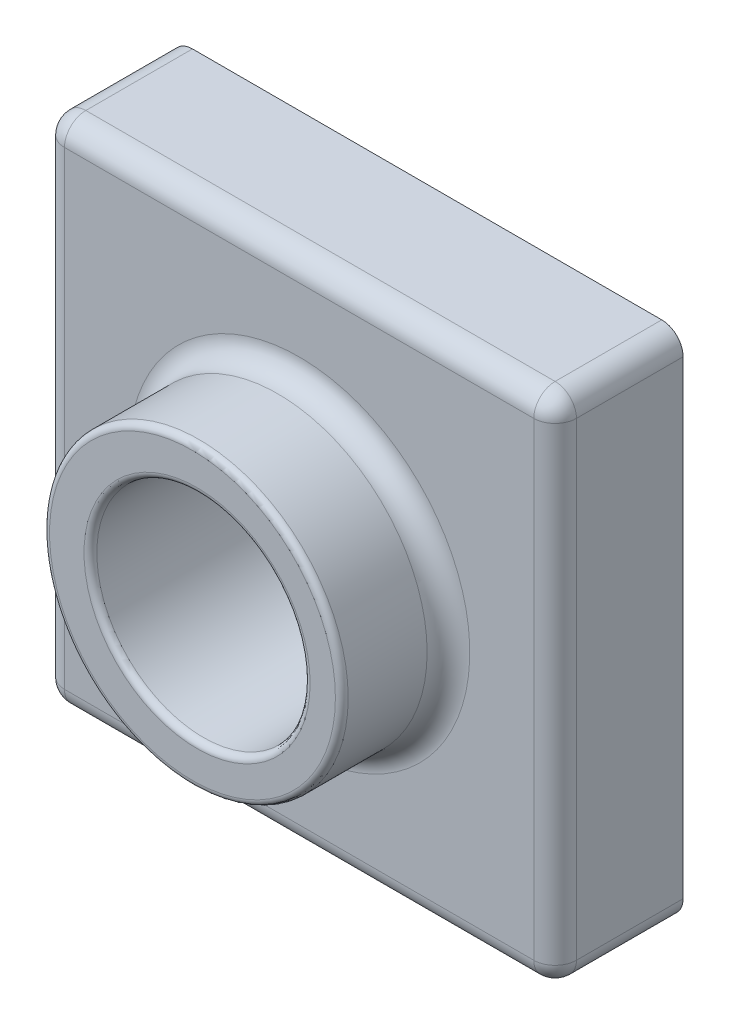
from build123d import *

# Parameters (mm, degrees)
SKETCH1_W           = 120
SKETCH1_H           = 120
BOSS_EXTRUDE1_DEPTH = 30
SKETCH2_R           = 35
BOSS_EXTRUDE2_DEPTH = 25
SKETCH5_R           = 25
CUT_EXTRUDE1_DEPTH  = 179.395627749
FILLET1_R           = 5
FILLET2_R           = 1.5
SHELL1_T            = -2


with BuildPart() as part:
    # Sketch1 → Boss-Extrude1 (new body)
    with BuildSketch(Plane.XY):
        with Locations((60, 60)):
            Rectangle(SKETCH1_W, SKETCH1_H)
    extrude(amount=BOSS_EXTRUDE1_DEPTH)

    # Sketch2 → Boss-Extrude2 (add)
    with BuildSketch(Plane.XY.offset(30)):
        with Locations((60, 60)):
            Circle(SKETCH2_R)
    extrude(amount=BOSS_EXTRUDE2_DEPTH)

    # Sketch5 → Cut-Extrude1 (cut, through all)
    with BuildSketch(Plane.XY.offset(55)):
        with Locations((61.077689107, 60)):
            Circle(SKETCH5_R)
    extrude(amount=-CUT_EXTRUDE1_DEPTH, mode=Mode.SUBTRACT)

    # Fillet1
    fillet1_edges = [part.edges().sort_by_distance(p)[0] for p in [
        (0, 60, 30),
        (60, 0, 30),
        (25, 60, 30),
        (120, 60, 30),
        (120, 0, 15),
        (0, 0, 15),
        (0, 120, 15),
        (120, 120, 15),
        (60, 120, 30),
    ]]
    fillet(fillet1_edges, radius=FILLET1_R)

    # Fillet2
    fillet2_edges = [part.edges().sort_by_distance(p)[0] for p in [
        (25, 60, 55),
        (36.077689107, 60, 55),
    ]]
    fillet(fillet2_edges, radius=FILLET2_R)

    # Shell1
    shell1_openings = [part.faces().sort_by_distance(p)[0] for p in [
        (60, 1.697056275, 0),
    ]]
    offset(amount=SHELL1_T, openings=shell1_openings, kind=Kind.INTERSECTION)


solid = part.part
